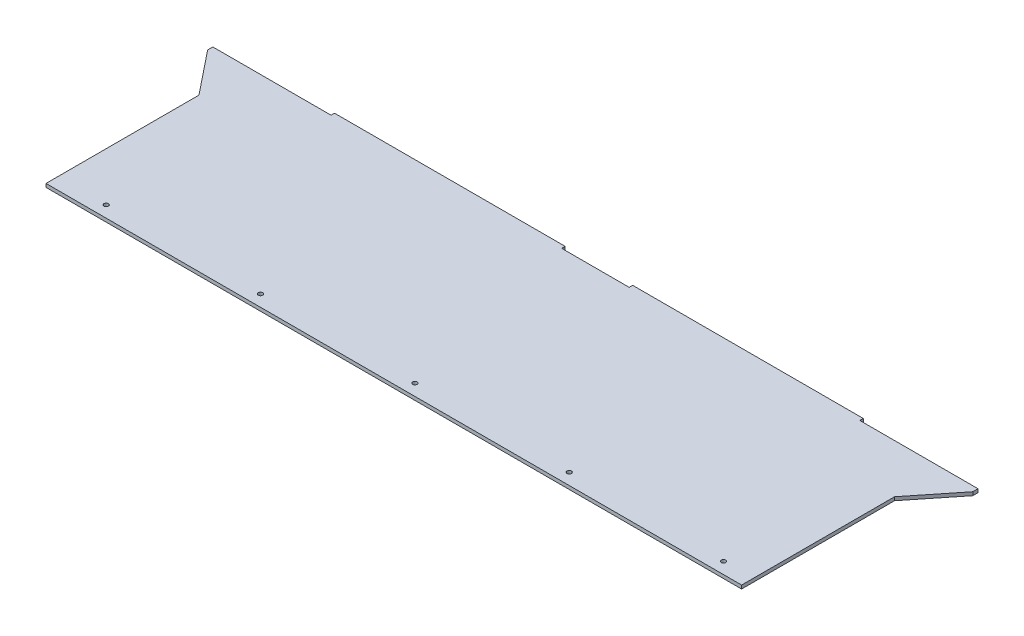
from build123d import *

# Parameters (mm, degrees)
SKETCH1_W           = 635.3556
SKETCH1_H           = 184.15
BOSS_EXTRUDE1_DEPTH = 1.5875
SKETCH2_W           = 210.6549
SKETCH2_H           = 3.175
BOSS_EXTRUDE2_DEPTH = 3.175
BOSS_EXTRUDE3_DEPTH = 3.175
CUT_EXTRUDE1_DEPTH  = 10
LPATTERN1_COUNT     = 5
LPATTERN1_PITCH     = 140.97


with BuildPart() as part:
    # Sketch1 → Boss-Extrude1 (new, symmetric)
    with BuildSketch(Plane(origin=(0, 0, 0), x_dir=(1, 0, 0), z_dir=(0, 1, 0))):
        Rectangle(SKETCH1_W, SKETCH1_H)
    extrude(amount=BOSS_EXTRUDE1_DEPTH, both=True)

    # Sketch2 → Boss-Extrude2 (add)
    with BuildSketch(Plane(origin=(0, 0, -92.075), x_dir=(-1, 0, 0), z_dir=(0, 0, -1))):
        with Locations((-136.15035, 0)):
            Rectangle(SKETCH2_W, SKETCH2_H)
        with Locations((136.15035, 0)):
            Rectangle(SKETCH2_W, SKETCH2_H)
    extrude(amount=BOSS_EXTRUDE2_DEPTH)

    # Sketch3 → Boss-Extrude3 (add)
    with BuildSketch(Plane(origin=(0, 1.5875, 0), x_dir=(1, 0, 0), z_dir=(0, 1, 0))):
        Polygon((-317.6778, 47.625), (-317.6778, 92.075), (-349.4278, 92.075), (-349.4278, 87.3125), align=None)
    boss_extrude3 = extrude(amount=-BOSS_EXTRUDE3_DEPTH)

    # Mirror1: Boss-Extrude3 across plane
    add(boss_extrude3.mirror(Plane(origin=(0, 0, 0), x_dir=(0, 0, 1), z_dir=(1, 0, 0))))

    # Sketch4 → Cut-Extrude1 (cut)
    with BuildSketch(Plane(origin=(0, 1.5875, 0), x_dir=(1, 0, 0), z_dir=(0, 1, 0))):
        with BuildLine():
            ThreePointArc((-275.2528, -81.534), (-274.659691232, -82.965891232), (-273.2278, -83.559))
            Line((-273.2278, -83.559), (-273.2278, -81.534))
            Line((-273.2278, -81.534), (-275.2528, -81.534))
        make_face()
        with BuildLine():
            Line((-273.2278, -81.534), (-273.2278, -83.559))
            ThreePointArc((-273.2278, -83.559), (-271.795908768, -82.965891232), (-271.2028, -81.534))
            ThreePointArc((-271.2028, -81.534), (-273.2278, -79.509), (-275.2528, -81.534))
            Line((-275.2528, -81.534), (-273.2278, -81.534))
        make_face()
    cut_extrude1 = extrude(amount=-CUT_EXTRUDE1_DEPTH, mode=Mode.SUBTRACT)

    # LPattern1: Cut-Extrude1 ×5
    with Locations(*[(i * LPATTERN1_PITCH, 0, 0) for i in range(1, LPATTERN1_COUNT)]):
        add(cut_extrude1, mode=Mode.SUBTRACT)


solid = part.part
